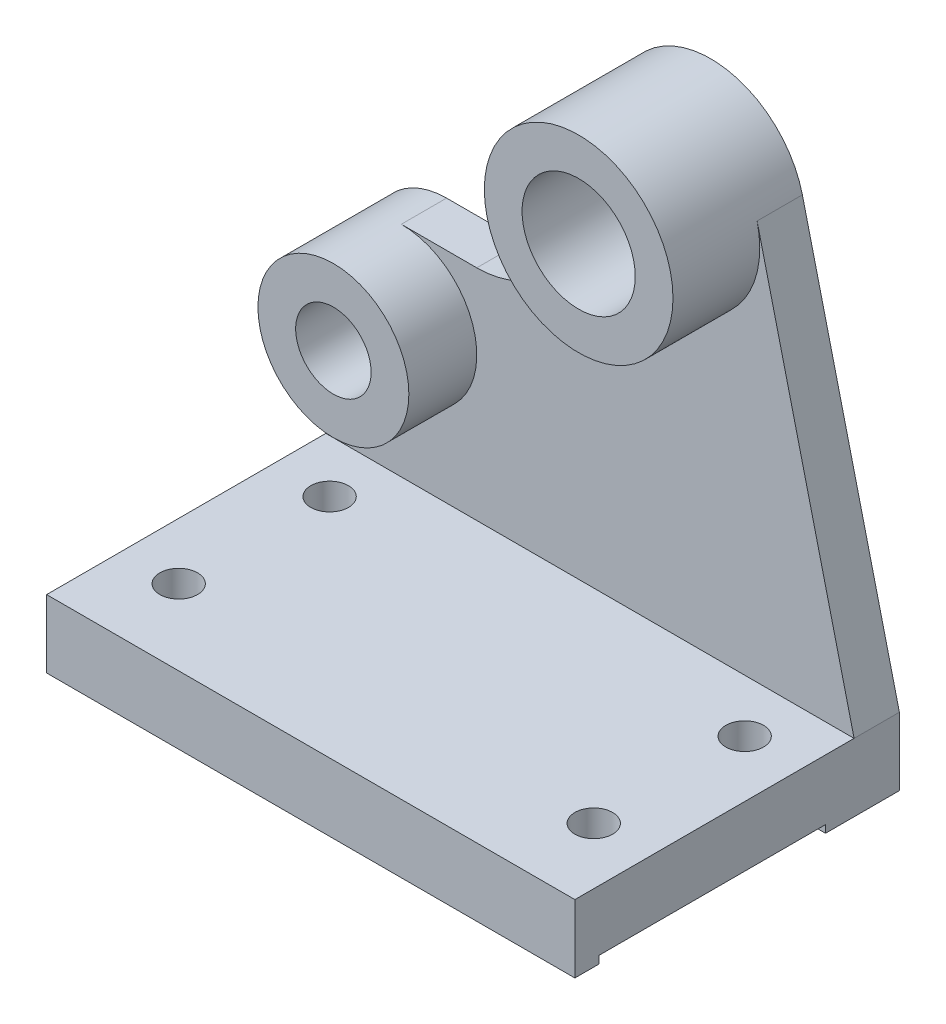
from build123d import *

# Parameters (mm, degrees)
SKETCH4_W           = 140
SKETCH4_H           = 18
BOSS_EXTRUDE1_DEPTH = 86
BOSS_EXTRUDE3_DEPTH = 12
SKETCH6_5_R         = 15
BOSS_EXTRUDE4_DEPTH = 35
SKETCH6_6_R         = 10
BOSS_EXTRUDE5_DEPTH = 30
SKETCH11_R          = 5
CUT_EXTRUDE1_DEPTH  = 168.095780916
SKETCH12_W          = 60
SKETCH12_H          = 16.179667724
CUT_EXTRUDE2_DEPTH  = 207.448540804


with BuildPart() as part:
    # Sketch4 → Boss-Extrude1 (new body)
    with BuildSketch(Plane.XY):
        with Locations((0, -9)):
            Rectangle(SKETCH4_W, SKETCH4_H)
    extrude(amount=BOSS_EXTRUDE1_DEPTH)

    # Sketch6 → Boss-Extrude3 (add)
    with BuildSketch(Plane.XY):
        with BuildLine():
            Line((-70, 38), (-70, 0))
            Line((-70, 0), (70, 0))
            Line((70, 0), (44.294494718, 105.897247359))
            ThreePointArc((44.294494718, 105.897247359), (44.822997079, 102.969649142), (45, 100))
            ThreePointArc((45, 100), (20, 75), (-5, 100))
            Line((-5, 100), (-5, 83))
            ThreePointArc((-5, 83), (-12.32233047, 65.32233047), (-30, 58))
            Line((-30, 58), (-50, 58))
            ThreePointArc((-50, 58), (-35.857864376, 52.142135624), (-30, 38))
            ThreePointArc((-30, 38), (-50, 18), (-70, 38))
        make_face()
    extrude(amount=BOSS_EXTRUDE3_DEPTH)

    # Sketch6<5> → Boss-Extrude4 (add)
    with BuildSketch(Plane.XY):
        with BuildLine():
            ThreePointArc((45, 100), (44.822997079, 102.969649142), (44.294494718, 105.897247359))
            ThreePointArc((44.294494718, 105.897247359), (17.030350858, 124.822997079), (-5, 100))
            ThreePointArc((-5, 100), (20, 75), (45, 100))
        make_face()
        with Locations((20, 100)):
            Circle(SKETCH6_5_R, mode=Mode.SUBTRACT)
    extrude(amount=BOSS_EXTRUDE4_DEPTH)

    # Sketch6<6> → Boss-Extrude5 (add)
    with BuildSketch(Plane.XY):
        with BuildLine():
            ThreePointArc((-50, 58), (-64.142135624, 52.142135624), (-70, 38))
            ThreePointArc((-70, 38), (-50, 18), (-30, 38))
            ThreePointArc((-30, 38), (-35.857864376, 52.142135624), (-50, 58))
        make_face()
        with Locations((-50, 38)):
            Circle(SKETCH6_6_R, mode=Mode.SUBTRACT)
    extrude(amount=BOSS_EXTRUDE5_DEPTH)

    # Sketch11 → Cut-Extrude1 (cut, through all)
    with BuildSketch(Plane(origin=(0, 0, 0), x_dir=(1, 0, 0), z_dir=(0, 1, 0))):
        with Locations((-55, -66)):
            Circle(SKETCH11_R)
        with Locations((-55, -26)):
            Circle(SKETCH11_R)
        with Locations((55, -26)):
            Circle(SKETCH11_R)
        with Locations((55, -66)):
            Circle(SKETCH11_R)
    extrude(amount=-CUT_EXTRUDE1_DEPTH, mode=Mode.SUBTRACT)

    # Sketch12 → Cut-Extrude2 (cut, through all)
    with BuildSketch(Plane(origin=(70, 0, 0), x_dir=(0, 0, -1), z_dir=(1, 0, 0))):
        with Locations((-49.575704937, -24.089833862)):
            Rectangle(SKETCH12_W, SKETCH12_H)
    extrude(amount=-CUT_EXTRUDE2_DEPTH, mode=Mode.SUBTRACT)


solid = part.part
